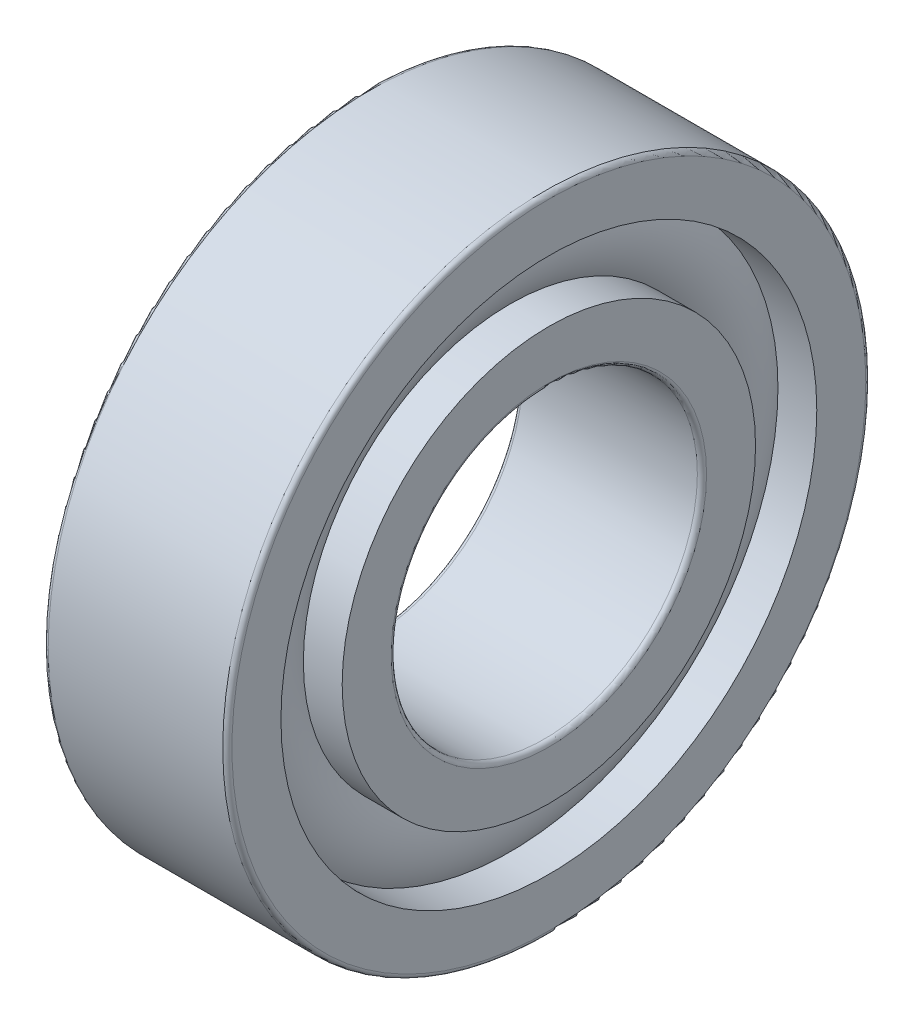
from build123d import *

# Parameters (mm, degrees)
FILLET1_R = 0.3


with BuildPart() as part:
    # Sketch1 → Revolve1 (revolve)
    with BuildSketch(Plane.XY):
        with BuildLine():
            Line((-6, 21), (6, 21))
            Line((6, 21), (6, 17.5))
            Line((6, 17.5), (3.464101615, 17.5))
            ThreePointArc((3.464101615, 17.5), (4, 15.5), (3.464101615, 13.5))
            Line((3.464101615, 13.5), (6, 13.5))
            Line((6, 13.5), (6, 10))
            Line((6, 10), (-6, 10))
            Line((-6, 10), (-6, 13.5))
            Line((-6, 13.5), (-3.464101615, 13.5))
            ThreePointArc((-3.464101615, 13.5), (-4, 15.5), (-3.464101615, 17.5))
            Line((-3.464101615, 17.5), (-6, 17.5))
            Line((-6, 17.5), (-6, 21))
        make_face()
    revolve(axis=Axis((60.829082801, 0, 0), (-1, 0, 0)))

    # Fillet1
    fillet1_edges = [part.edges().sort_by_distance(p)[0] for p in [
        (-6, -10, 0),
        (6, -10, 0),
        (6, -21, 0),
        (-6, -21, 0),
    ]]
    fillet(fillet1_edges, radius=FILLET1_R)


solid = part.part
